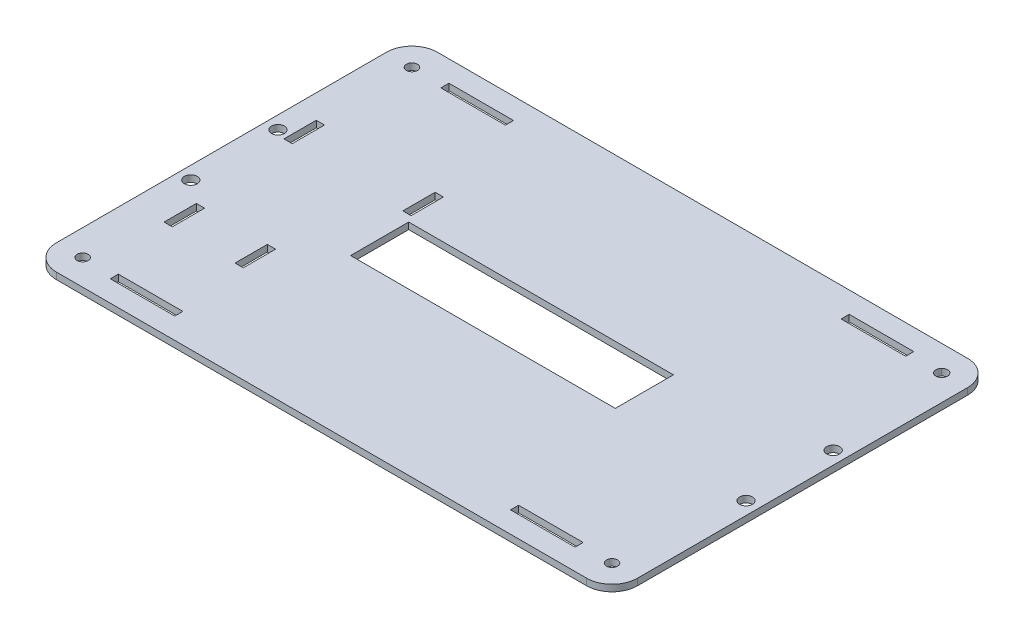
from build123d import *

# Parameters (mm, degrees)
SKETCH1_W           = 228.6
SKETCH1_H           = 149.86
SKETCH1_R           = 2.54
SKETCH1_R_2         = 2.159
SKETCH1_W_2         = 25.4
SKETCH1_H_2         = 3.175
BOSS_EXTRUDE1_DEPTH = 2.6
FILLET1_R           = 10
SKETCH6_R           = 2.159
CUT_EXTRUDE6_DEPTH  = 2.6
SKETCH15_R          = 10
CUT_EXTRUDE14_DEPTH = 274.354604132
SKETCH25_W          = 104.14
SKETCH25_H          = 22.86
SKETCH25_W_2        = 3.2385
SKETCH25_H_2        = 12.7
CUT_EXTRUDE18_DEPTH = 10.16


with BuildPart() as part:
    # Sketch1 → Boss-Extrude1 (new body)
    with BuildSketch(Plane(origin=(0, 0, 0), x_dir=(1, 0, 0), z_dir=(0, 1, 0))):
        with Locations((114.3, -74.93)):
            Rectangle(SKETCH1_W, SKETCH1_H)
        with Locations(Location((5.08, -57.785, 0), (0, 0, 270))):
            Circle(SKETCH1_R, mode=Mode.SUBTRACT)
        with Locations(Location((5.08, -92.075, 0), (0, 0, 270))):
            Circle(SKETCH1_R, mode=Mode.SUBTRACT)
        with Locations(Location((223.52, -92.075, 0), (0, 0, 270))):
            Circle(SKETCH1_R, mode=Mode.SUBTRACT)
        with Locations(Location((223.52, -57.785, 0), (0, 0, 270))):
            Circle(SKETCH1_R, mode=Mode.SUBTRACT)
        with Locations(Location((218.44, -10.16, 0), (0, 0, 270))):
            Circle(SKETCH1_R_2, mode=Mode.SUBTRACT)
        with Locations(Location((10.16, -10.16, 0), (0, 0, 270))):
            Circle(SKETCH1_R_2, mode=Mode.SUBTRACT)
        with Locations(Location((218.44, -139.7, 0), (0, 0, 270))):
            Circle(SKETCH1_R_2, mode=Mode.SUBTRACT)
        with Locations(Location((10.16, -139.7, 0), (0, 0, 270))):
            Circle(SKETCH1_R_2, mode=Mode.SUBTRACT)
        with Locations((35.56, -9.887961988)):
            Rectangle(SKETCH1_W_2, SKETCH1_H_2, mode=Mode.SUBTRACT)
        with Locations((193.04, -9.887961988)):
            Rectangle(SKETCH1_W_2, SKETCH1_H_2, mode=Mode.SUBTRACT)
        with Locations((193.04, -139.972038012)):
            Rectangle(SKETCH1_W_2, SKETCH1_H_2, mode=Mode.SUBTRACT)
        with Locations((35.56, -139.972038012)):
            Rectangle(SKETCH1_W_2, SKETCH1_H_2, mode=Mode.SUBTRACT)
    extrude(amount=BOSS_EXTRUDE1_DEPTH)

    # Fillet1
    fillet1_edges = [part.edges().sort_by_distance(p)[0] for p in [
        (0, 1.3, 0),
        (228.6, 1.3, 0),
        (228.6, 1.3, 149.86),
        (0, 1.3, 149.86),
    ]]
    fillet(fillet1_edges, radius=FILLET1_R)

    # Sketch6 → Cut-Extrude6 (cut)
    with BuildSketch(Plane.XZ):
        with Locations((218.6, 10)):
            Circle(SKETCH6_R)
    extrude(amount=-CUT_EXTRUDE6_DEPTH, mode=Mode.SUBTRACT)

    # Sketch15 → Cut-Extrude14 (cut, through all)
    with BuildSketch(Plane.XZ):
        with Locations(Location((114.3, 74.93, 0), (0, 0, 270))):
            Circle(SKETCH15_R)
    extrude(amount=-CUT_EXTRUDE14_DEPTH, mode=Mode.SUBTRACT)

    # Sketch25 → Cut-Extrude18 (cut)
    with BuildSketch(Plane(origin=(0, 2.6, 0), x_dir=(1, 0, 0), z_dir=(0, 1, 0))):
        with Locations((114.3, -74.93)):
            Rectangle(SKETCH25_W, SKETCH25_H)
        with Locations((10.991446919, -53.364023976)):
            Rectangle(SKETCH25_W_2, SKETCH25_H_2)
        with Locations((58.908546919, -54.507023976)):
            Rectangle(SKETCH25_W_2, SKETCH25_H_2)
        with Locations((15.741246919, -105.294323976)):
            Rectangle(SKETCH25_W_2, SKETCH25_H_2)
        with Locations((43.668546919, -105.294323976)):
            Rectangle(SKETCH25_W_2, SKETCH25_H_2)
    extrude(amount=-CUT_EXTRUDE18_DEPTH, mode=Mode.SUBTRACT)


solid = part.part
